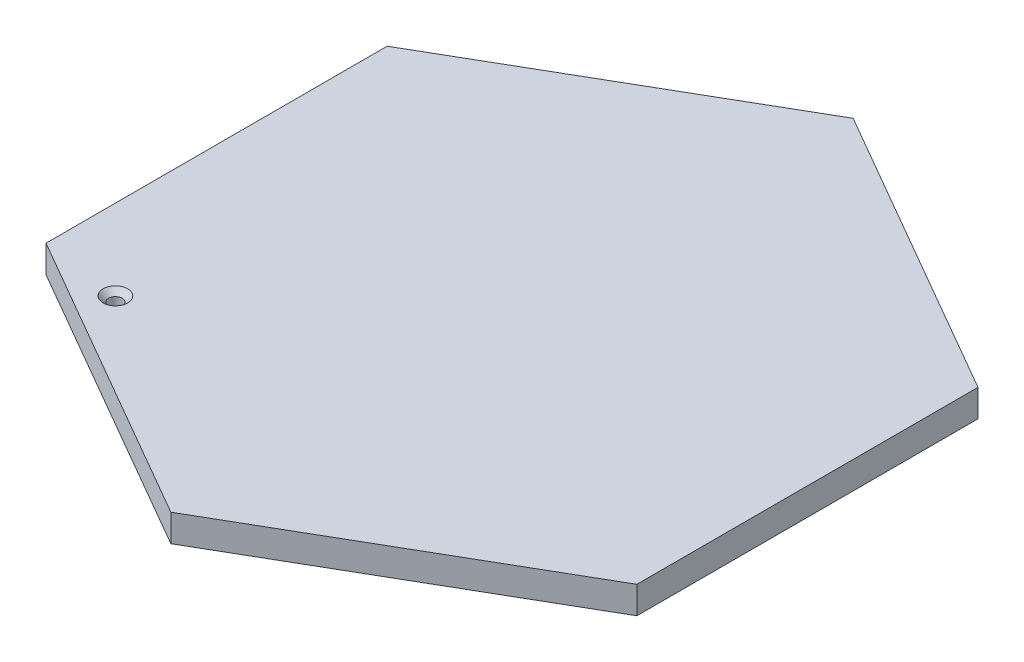
from build123d import *

# Parameters (mm, degrees)
BOSS_EXTRUDE1_DEPTH                                  = 4
CSK_FOR_M1_6_COUNTERSUNK_FLAT_HEAD_SCREW_D           = 2
CSK_FOR_M1_6_COUNTERSUNK_FLAT_HEAD_SCREW_CSINK_D     = 3.6
CSK_FOR_M1_6_COUNTERSUNK_FLAT_HEAD_SCREW_CSINK_ANGLE = 90


with BuildPart() as part:
    # Sketch1 → Boss-Extrude1 (new body)
    with BuildSketch(Plane(origin=(0, 0, 0), x_dir=(1, 0, 0), z_dir=(0, 1, 0))):
        Polygon((0, 50), (-43.301270189, 25), (-43.301270189, -25), (0, -50), (43.301270189, -25), (43.301270189, 25), align=None)
    extrude(amount=BOSS_EXTRUDE1_DEPTH)

    # CSK for M1.6 Countersunk Flat Head Screw1 (through all)
    with Locations(Plane(origin=(-40.56776455, 4, -91.833285009), x_dir=(1, 0, 0), z_dir=(0, 1, 0))):
        with Locations((9.042773802, -118.436170692)):
            CounterSinkHole(CSK_FOR_M1_6_COUNTERSUNK_FLAT_HEAD_SCREW_D / 2, CSK_FOR_M1_6_COUNTERSUNK_FLAT_HEAD_SCREW_CSINK_D / 2, counter_sink_angle=CSK_FOR_M1_6_COUNTERSUNK_FLAT_HEAD_SCREW_CSINK_ANGLE)


solid = part.part
